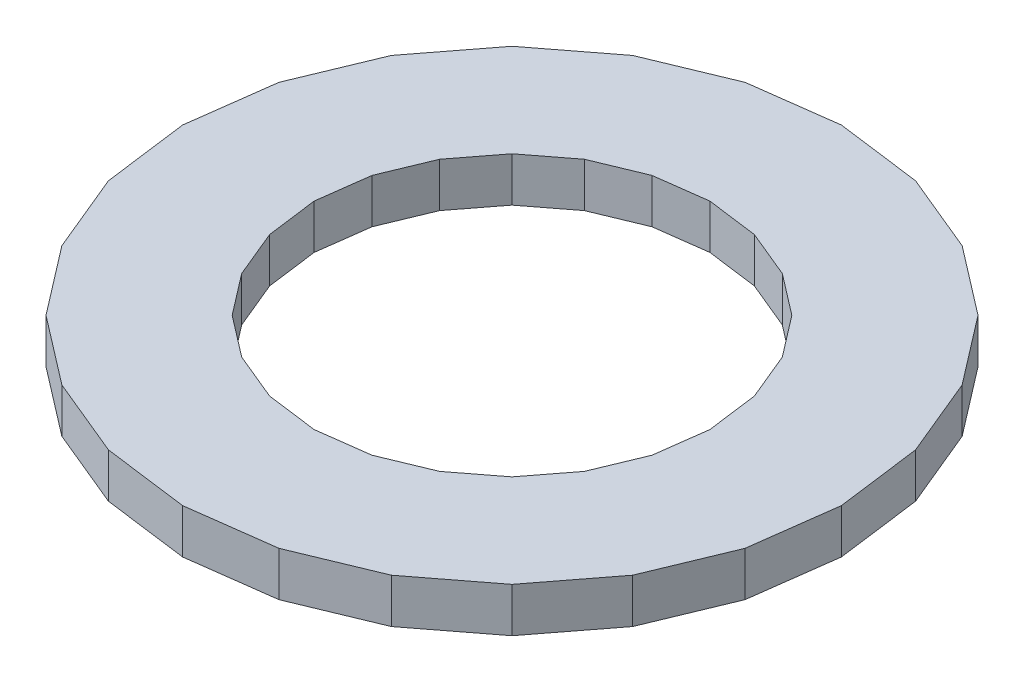
from build123d import *

# Parameters (mm, degrees)
BOSS_EXTRUDE2_DEPTH = 19.05


with BuildPart() as part:
    # Sketch2 → Boss-Extrude2 (new body)
    with BuildSketch(Plane(origin=(0, 0, 0), x_dir=(1, 0, 0), z_dir=(0, 1, 0))):
        Polygon((-141.082794854, 0), (-136.275515194, -36.514914244), (-122.18128438, -70.541397427), (-99.76060095, -99.76060095), (-70.541397427, -122.18128438), (-36.514914244, -136.275515194), (0, -141.082794854), (36.514914244, -136.275515194), (70.541397427, -122.18128438), (99.76060095, -99.76060095), (122.18128438, -70.541397427), (136.275515194, -36.514914244), (141.082794854, 0), (136.275515194, 36.514914244), (122.18128438, 70.541397427), (99.76060095, 99.76060095), (70.541397427, 122.18128438), (36.514914244, 136.275515194), (0, 141.082794854), (-36.514914244, 136.275515194), (-70.541397427, 122.18128438), (-99.76060095, 99.76060095), (-122.18128438, 70.541397427), (-136.275515194, 36.514914244), align=None)
        Polygon((-84.720608536, 0), (-81.833823804, -21.927307002), (-73.370199217, -42.360304268), (-59.906516802, -59.906516802), (-42.360304268, -73.370199217), (-21.927307002, -81.833823804), (0, -84.720608536), (21.927307002, -81.833823804), (42.360304268, -73.370199217), (59.906516802, -59.906516802), (73.370199217, -42.360304268), (81.833823804, -21.927307002), (84.720608536, 0), (81.833823804, 21.927307002), (73.370199217, 42.360304268), (59.906516802, 59.906516802), (42.360304268, 73.370199217), (21.927307002, 81.833823804), (0, 84.720608536), (-21.927307002, 81.833823804), (-42.360304268, 73.370199217), (-59.906516802, 59.906516802), (-73.370199217, 42.360304268), (-81.833823804, 21.927307002), align=None, mode=Mode.SUBTRACT)
    extrude(amount=BOSS_EXTRUDE2_DEPTH)


solid = part.part
